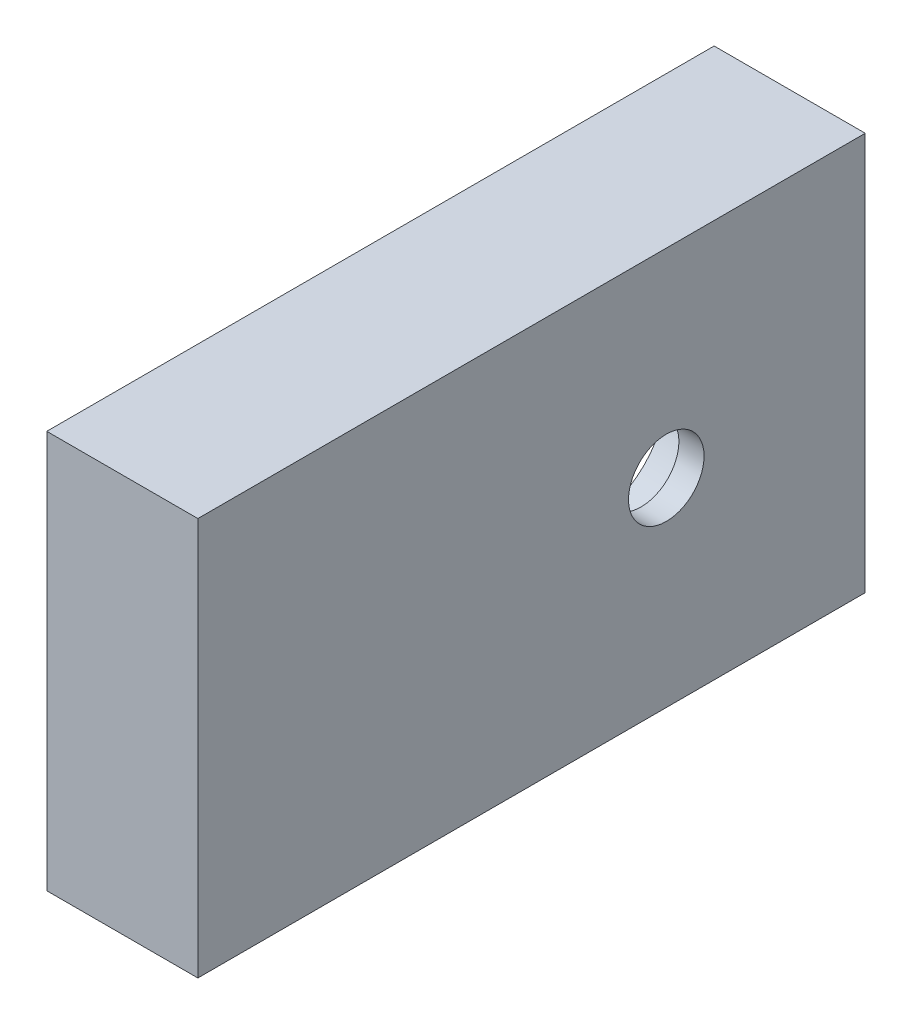
from build123d import *

# Parameters (mm, degrees)
SKETCH1_W           = 26.5
SKETCH1_H           = 15.8
SKETCH1_W_2         = 22.5
SKETCH1_H_2         = 11.8
BOSS_EXTRUDE1_DEPTH = 3
SKETCH2_W           = 26.5
SKETCH2_H           = 15.8
SKETCH2_R           = 1.5
BOSS_EXTRUDE2_DEPTH = 3
SKETCH3_R           = 3
CUT_EXTRUDE1_DEPTH  = 2


with BuildPart() as part:
    # Sketch1 → Boss-Extrude1 (new body)
    with BuildSketch(Plane(origin=(0, 0, 0), x_dir=(0, 0, -1), z_dir=(1, 0, 0))):
        with Locations((-5.35, 0)):
            Rectangle(SKETCH1_W, SKETCH1_H)
        with Locations((-5.35, 0)):
            Rectangle(SKETCH1_W_2, SKETCH1_H_2, mode=Mode.SUBTRACT)
    extrude(amount=BOSS_EXTRUDE1_DEPTH)

    # Sketch2 → Boss-Extrude2 (add)
    with BuildSketch(Plane(origin=(3, 0, 0), x_dir=(0, 0, -1), z_dir=(1, 0, 0))):
        with Locations((-5.35, 0)):
            Rectangle(SKETCH2_W, SKETCH2_H)
        Circle(SKETCH2_R, mode=Mode.SUBTRACT)
    extrude(amount=BOSS_EXTRUDE2_DEPTH)

    # Sketch3 → Cut-Extrude1 (cut)
    with BuildSketch(Plane.ZY.offset(-3)):
        Circle(SKETCH3_R)
    extrude(amount=-CUT_EXTRUDE1_DEPTH, mode=Mode.SUBTRACT)


solid = part.part
